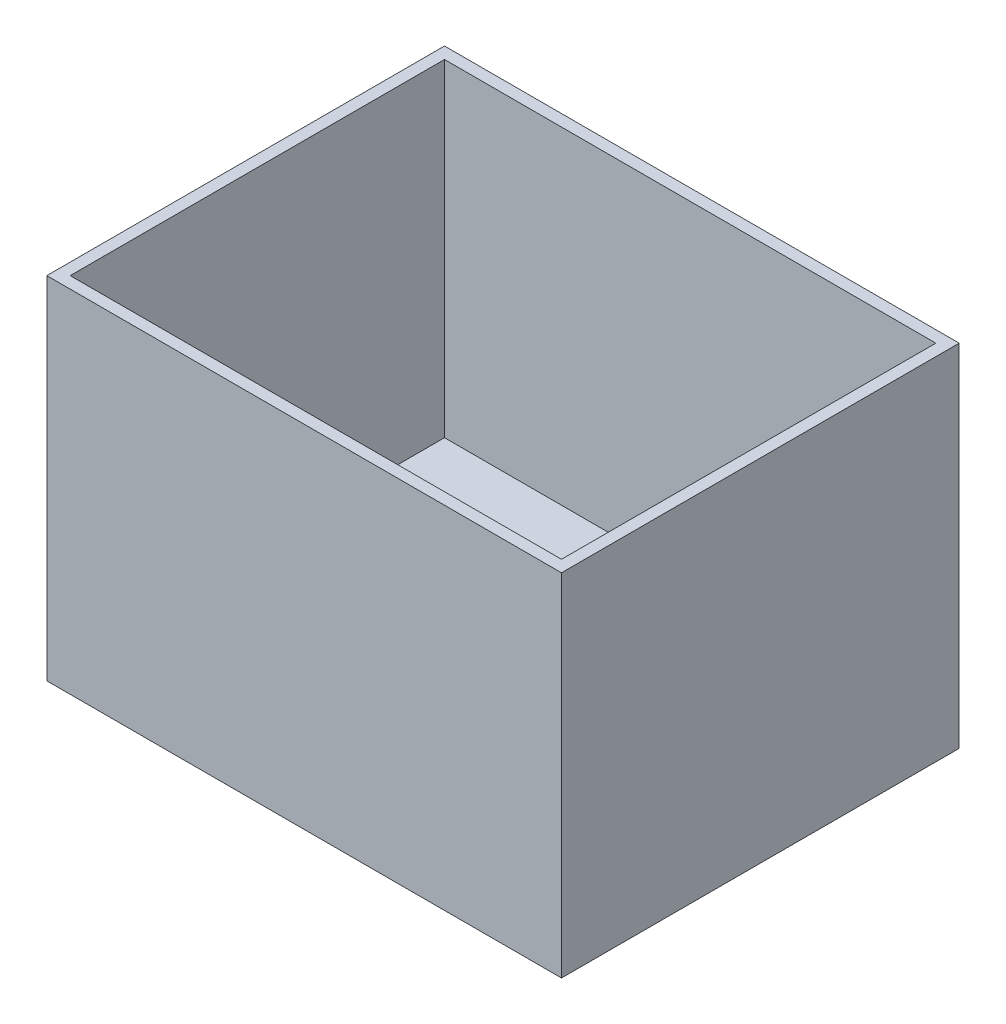
from build123d import *

# Parameters (mm, degrees)
SKETCH2_W           = 440
SKETCH2_H           = 340
BOSS_EXTRUDE1_DEPTH = 300
SKETCH3_W           = 420
SKETCH3_H           = 320
CUT_EXTRUDE1_DEPTH  = 280


with BuildPart() as part:
    # Sketch2 → Boss-Extrude1 (new body)
    with BuildSketch(Plane(origin=(0, 0, 0), x_dir=(1, 0, 0), z_dir=(0, 1, 0))):
        Rectangle(SKETCH2_W, SKETCH2_H)
    extrude(amount=BOSS_EXTRUDE1_DEPTH)

    # Sketch3 → Cut-Extrude1 (cut)
    with BuildSketch(Plane(origin=(0, 300, 0), x_dir=(1, 0, 0), z_dir=(0, 1, 0))):
        Rectangle(SKETCH3_W, SKETCH3_H)
    extrude(amount=-CUT_EXTRUDE1_DEPTH, mode=Mode.SUBTRACT)


solid = part.part
